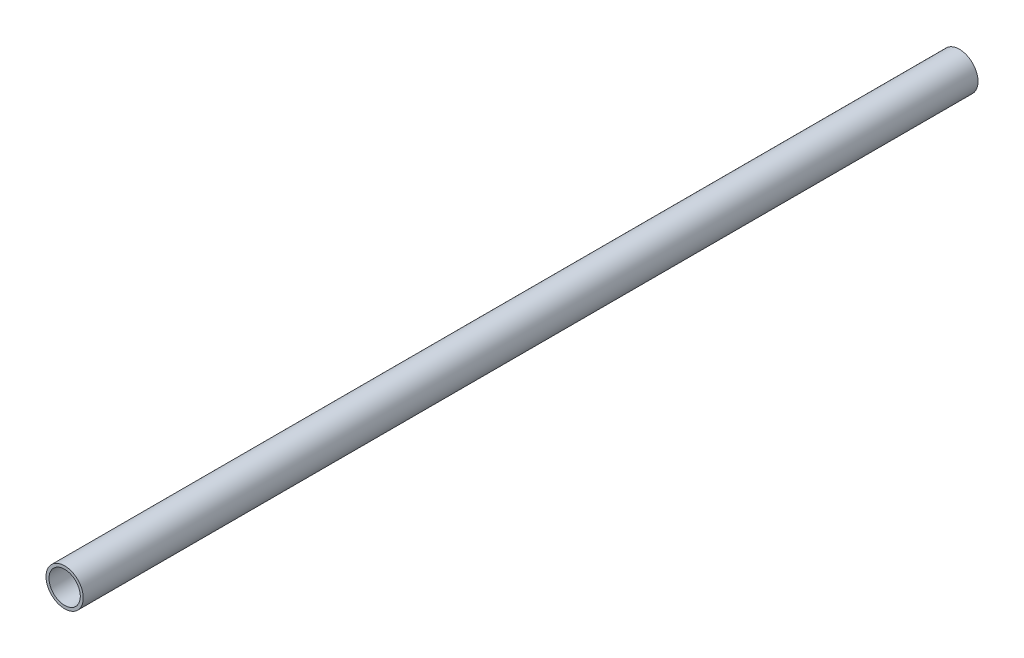
from build123d import *

# Parameters (mm, degrees)
SKETCH2_R           = 3.175
SKETCH2_R_2         = 2.667
BOSS_EXTRUDE1_DEPTH = 76.2


with BuildPart() as part:
    # Sketch2 → Boss-Extrude1 (new, symmetric)
    with BuildSketch(Plane.XY):
        Circle(SKETCH2_R)
        Circle(SKETCH2_R_2, mode=Mode.SUBTRACT)
    extrude(amount=BOSS_EXTRUDE1_DEPTH, both=True)


solid = part.part
